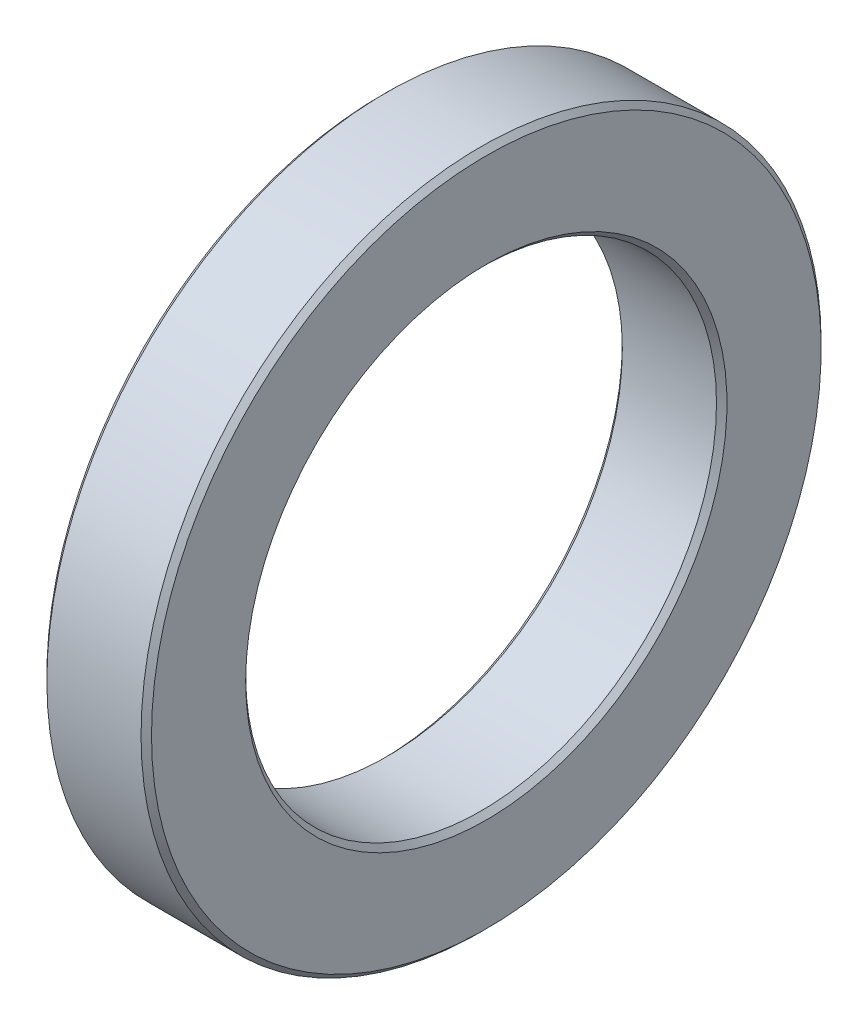
from build123d import *

# Parameters (mm, degrees)
SKETCH1_W     = 10
SKETCH1_H     = 10
CHAMFER1_SIZE = 0.5


with BuildPart() as part:
    # Sketch1 → Revolve1 (revolve)
    with BuildSketch(Plane.XY, mode=Mode.PRIVATE) as revolve1_sk:
        with Locations((5, 27.5)):
            Rectangle(SKETCH1_W, SKETCH1_H)
    revolve(revolve1_sk.sketch.rotate(Axis((0, 0, 0), (1, 0, 0)), 90), axis=Axis((0, 0, 0), (1, 0, 0)))

    # Chamfer1
    chamfer1_edges = [part.edges().sort_by_distance(p)[0] for p in [
        (0, 0, -32.5),
        (10, 0, -32.5),
        (10, 0, -22.5),
        (0, 0, -22.5),
    ]]
    chamfer(chamfer1_edges, length=CHAMFER1_SIZE)


solid = part.part
